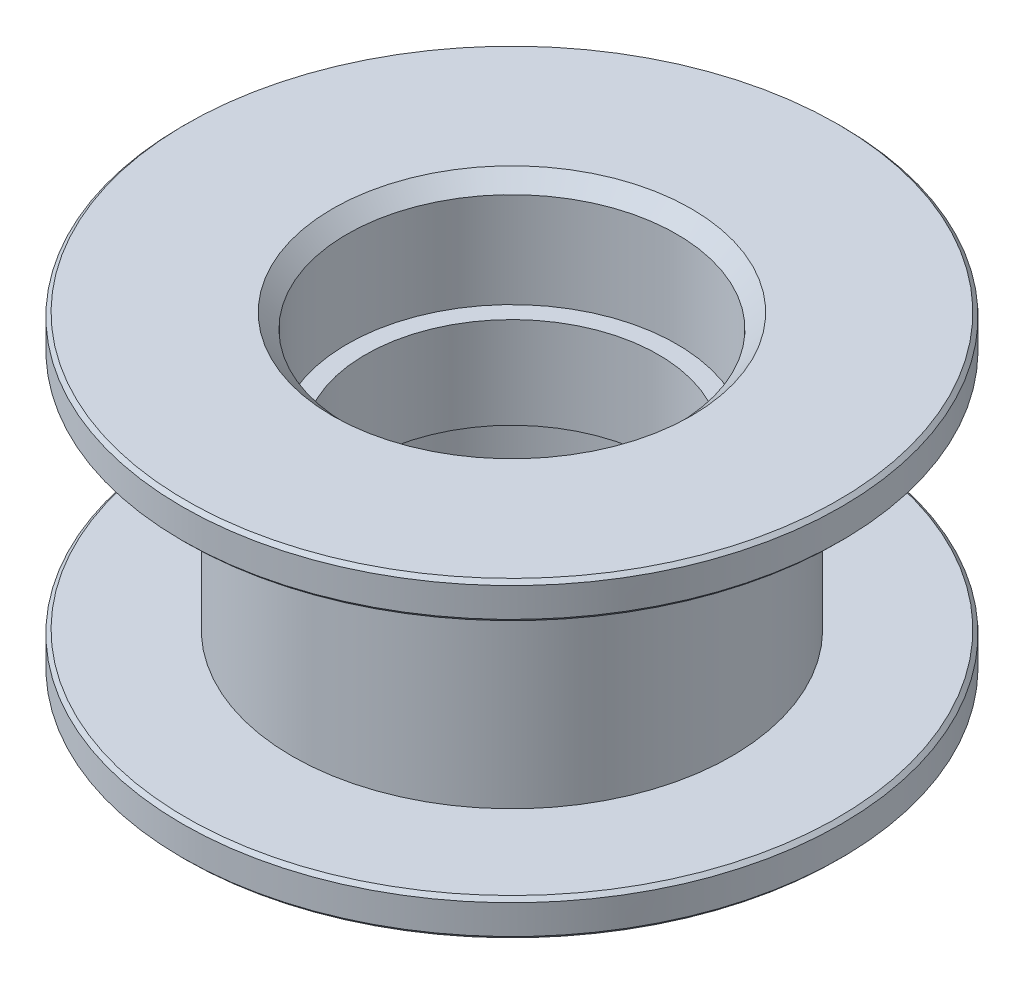
from build123d import *

# Parameters (mm, degrees)
INNERC_SIZE = 0.4
OUTERC_SIZE = 0.1


with BuildPart() as part:
    # BodyS → Body (revolve)
    with BuildSketch(Plane.XY, mode=Mode.PRIVATE) as body_sk:
        Polygon((6, -3.25), (6, 3.25), (9, 3.25), (9, 4.25), (4.5, 4.25), (4.5, 1.25), (4, 1.25), (4, -1.25), (4.5, -1.25), (4.5, -4.25), (9, -4.25), (9, -3.25), align=None)
    revolve(body_sk.sketch.rotate(Axis((0, 4.25, 0), (0, -1, 0)), 90), axis=Axis((0, 4.25, 0), (0, -1, 0)))

    # InnerC
    innerc_edges = [part.edges().sort_by_distance(p)[0] for p in [
        (0, -4.25, -4.5),
        (0, 4.25, -4.5),
    ]]
    chamfer(innerc_edges, length=INNERC_SIZE)

    # OuterC
    outerc_edges = [part.edges().sort_by_distance(p)[0] for p in [
        (0, 4.25, -9),
        (0, 3.25, -9),
        (0, -3.25, -9),
        (0, -4.25, -9),
    ]]
    chamfer(outerc_edges, length=OUTERC_SIZE)


solid = part.part
